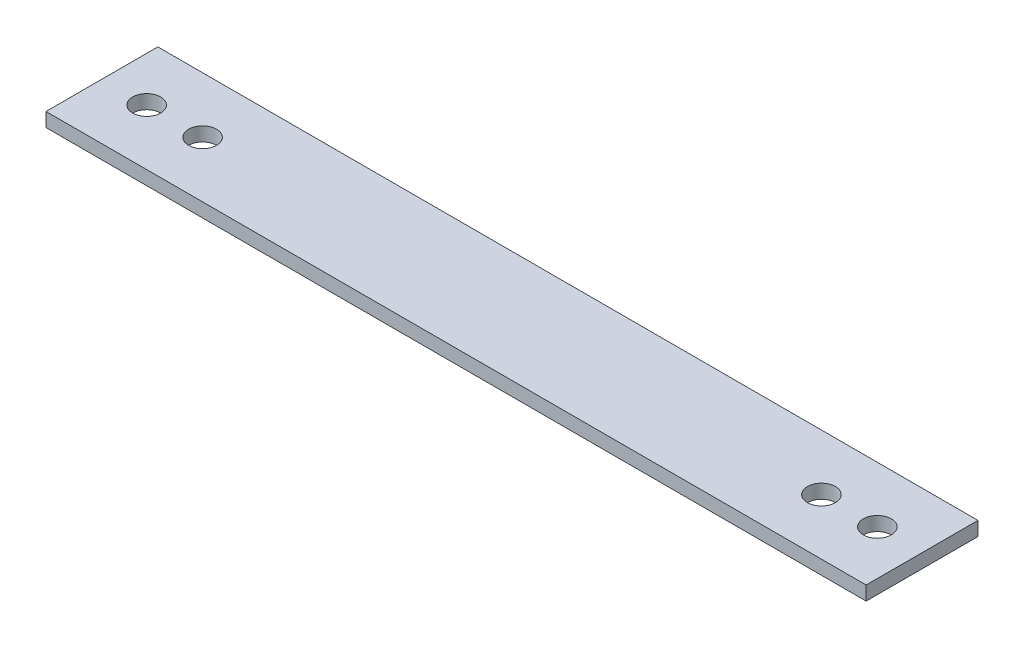
from build123d import *

# Parameters (mm, degrees)
SKETCH2_W           = 279.4
SKETCH2_H           = 38.1
SKETCH2_R           = 4.7625
BOSS_EXTRUDE1_DEPTH = 4.7625


with BuildPart() as part:
    # Sketch2 → Boss-Extrude1 (new body)
    with BuildSketch(Plane(origin=(0, 0, 0), x_dir=(1, 0, 0), z_dir=(0, 1, 0))):
        Rectangle(SKETCH2_W, SKETCH2_H)
        with Locations(Location((-124.46, 0, 0), (0, 0, 90))):
            Circle(SKETCH2_R, mode=Mode.SUBTRACT)
        with Locations(Location((-105.41, 0, 0), (0, 0, 90))):
            Circle(SKETCH2_R, mode=Mode.SUBTRACT)
        with Locations(Location((124.46, 0, 0), (0, 0, 90))):
            Circle(SKETCH2_R, mode=Mode.SUBTRACT)
        with Locations(Location((105.41, 0, 0), (0, 0, 90))):
            Circle(SKETCH2_R, mode=Mode.SUBTRACT)
    extrude(amount=BOSS_EXTRUDE1_DEPTH)


solid = part.part
